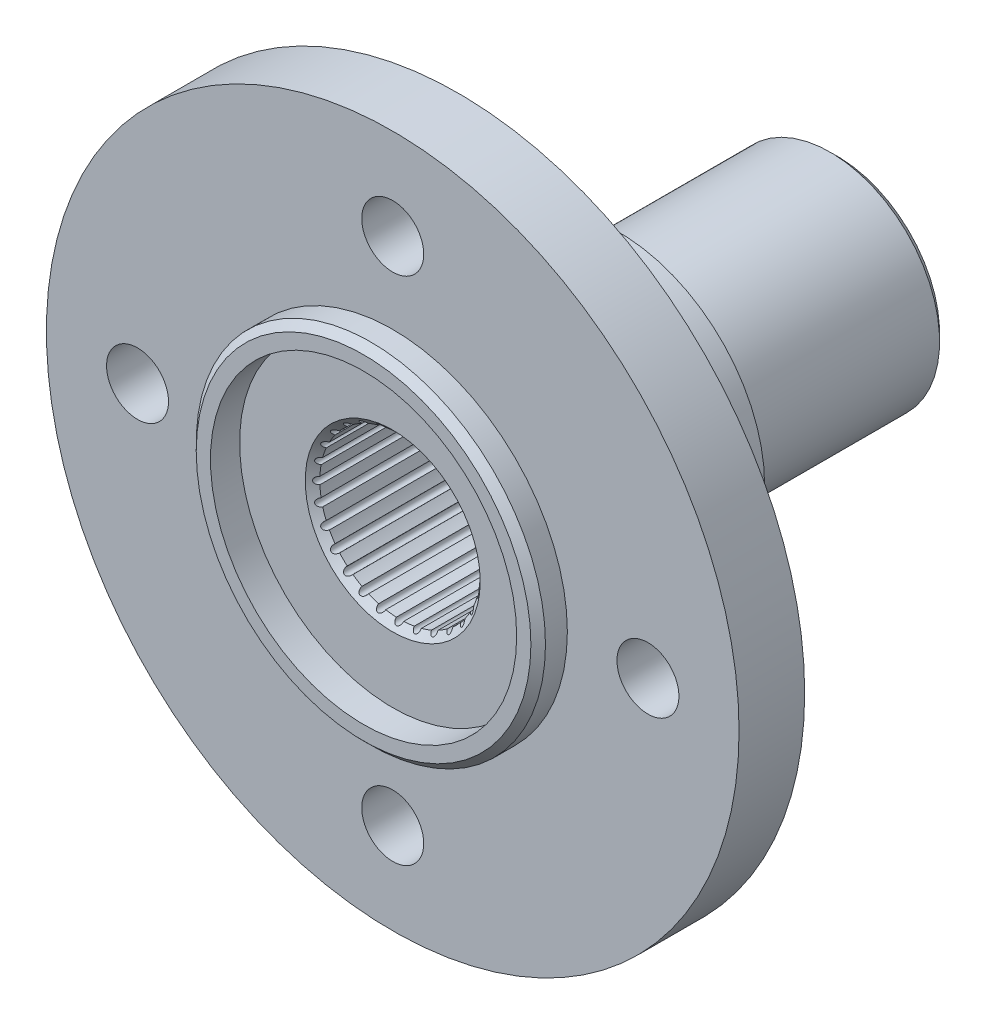
from build123d import *

# Parameters (mm, degrees)
SKETCH1_R           = 47.5
BOSS_EXTRUDE1_DEPTH = 9
SKETCH2_R           = 20
BOSS_EXTRUDE2_DEPTH = 22
SKETCH3_R           = 15
BOSS_EXTRUDE3_DEPTH = 30
SKETCH6_R           = 11
CUT_EXTRUDE2_DEPTH  = 25
CHAMFER2_SIZE       = 1
CUT_EXTRUDE5_REACH  = 92.739
SKETCH9_R           = 4.25
CHAMFER3_SIZE       = 1
SKETCH12_R          = 23.95
BOSS_EXTRUDE4_DEPTH = 4
SKETCH13_R          = 21
CUT_EXTRUDE6_DEPTH  = 4
CHAMFER4_SIZE       = 1
SKETCH8_R           = 0.5
CUT_EXTRUDE4_DEPTH  = 25
SKETCH14_R          = 11
CUT_EXTRUDE7_DEPTH  = 79.182478856
CHAMFER5_SIZE       = 1
SKETCH15_R          = 0.5
CUT_EXTRUDE8_DEPTH  = 94.474595479


with BuildPart() as part:
    # Sketch1 → Boss-Extrude1 (new body)
    with BuildSketch(Plane.XY):
        Circle(SKETCH1_R)
    extrude(amount=BOSS_EXTRUDE1_DEPTH)

    # Sketch2 → Boss-Extrude2 (add)
    with BuildSketch(Plane(origin=(0, 0, 0), x_dir=(-1, 0, 0), z_dir=(0, 0, -1))):
        Circle(SKETCH2_R)
    extrude(amount=BOSS_EXTRUDE2_DEPTH)

    # Sketch3 → Boss-Extrude3 (add)
    with BuildSketch(Plane(origin=(0, 0, -22), x_dir=(-1, 0, 0), z_dir=(0, 0, -1))):
        Circle(SKETCH3_R)
    extrude(amount=BOSS_EXTRUDE3_DEPTH)

    # Sketch6 → Cut-Extrude2 (cut)
    with BuildSketch(Plane(origin=(0, 0, -52), x_dir=(-1, 0, 0), z_dir=(0, 0, -1))):
        Circle(SKETCH6_R)
    extrude(amount=-CUT_EXTRUDE2_DEPTH, mode=Mode.SUBTRACT)

    # Chamfer2
    chamfer2_edges = [part.edges().sort_by_distance(p)[0] for p in [
        (11, 0, -52),
    ]]
    chamfer(chamfer2_edges, length=CHAMFER2_SIZE)

    # Sketch9 → Cut-Extrude5 (cut, up to next)
    with BuildSketch(Plane.XY.offset(9), mode=Mode.PRIVATE) as cut_extrude5_sk1:
        with Locations((0, 35)):
            Circle(SKETCH9_R)
    cut_extrude5_tool1 = extrude(cut_extrude5_sk1.sketch, amount=-CUT_EXTRUDE5_REACH, mode=Mode.PRIVATE) & part.part
    # Sketch9 → Cut-Extrude5 (cut, up to next)
    with BuildSketch(Plane.XY.offset(9), mode=Mode.PRIVATE) as cut_extrude5_sk2:
        with Locations((35, 0)):
            Circle(SKETCH9_R)
    cut_extrude5_tool2 = extrude(cut_extrude5_sk2.sketch, amount=-CUT_EXTRUDE5_REACH, mode=Mode.PRIVATE) & part.part
    # Sketch9 → Cut-Extrude5 (cut, up to next)
    with BuildSketch(Plane.XY.offset(9), mode=Mode.PRIVATE) as cut_extrude5_sk3:
        with Locations((0, -35)):
            Circle(SKETCH9_R)
    cut_extrude5_tool3 = extrude(cut_extrude5_sk3.sketch, amount=-CUT_EXTRUDE5_REACH, mode=Mode.PRIVATE) & part.part
    # Sketch9 → Cut-Extrude5 (cut, up to next)
    with BuildSketch(Plane.XY.offset(9), mode=Mode.PRIVATE) as cut_extrude5_sk4:
        with Locations((-35, 0)):
            Circle(SKETCH9_R)
    cut_extrude5_tool4 = extrude(cut_extrude5_sk4.sketch, amount=-CUT_EXTRUDE5_REACH, mode=Mode.PRIVATE) & part.part
    add(cut_extrude5_tool1.solids().sort_by_distance((0, 35, 9))[0], mode=Mode.SUBTRACT)
    add(cut_extrude5_tool2.solids().sort_by_distance((35, 0, 9))[0], mode=Mode.SUBTRACT)
    add(cut_extrude5_tool3.solids().sort_by_distance((0, -35, 9))[0], mode=Mode.SUBTRACT)
    add(cut_extrude5_tool4.solids().sort_by_distance((-35, 0, 9))[0], mode=Mode.SUBTRACT)

    # Chamfer3
    chamfer3_edges = [part.edges().sort_by_distance(p)[0] for p in [
        (15, 0, -52),
    ]]
    chamfer(chamfer3_edges, length=CHAMFER3_SIZE)

    # Sketch12 → Boss-Extrude4 (add)
    with BuildSketch(Plane.XY.offset(9)):
        Circle(SKETCH12_R)
    extrude(amount=BOSS_EXTRUDE4_DEPTH)

    # Sketch13 → Cut-Extrude6 (cut)
    with BuildSketch(Plane.XY.offset(13)):
        Circle(SKETCH13_R)
    extrude(amount=-CUT_EXTRUDE6_DEPTH, mode=Mode.SUBTRACT)

    # Chamfer4
    chamfer4_edges = [part.edges().sort_by_distance(p)[0] for p in [
        (-23.95, 0, 13),
    ]]
    chamfer(chamfer4_edges, length=CHAMFER4_SIZE)

    # Sketch8 → Cut-Extrude4 (cut)
    with BuildSketch(Plane(origin=(0, 0, -52), x_dir=(-1, 0, 0), z_dir=(0, 0, -1))):
        with Locations((0, 11)):
            Circle(SKETCH8_R)
        with Locations((2.447730274, 10.724207034)):
            Circle(SKETCH8_R)
        with Locations((4.77272113, 9.910657547)):
            Circle(SKETCH8_R)
        with Locations((6.85838782, 8.600146307)):
            Circle(SKETCH8_R)
        with Locations((8.600146307, 6.85838782)):
            Circle(SKETCH8_R)
        with Locations((9.910657547, 4.77272113)):
            Circle(SKETCH8_R)
        with Locations((10.724207034, 2.447730274)):
            Circle(SKETCH8_R)
        with Locations((11, 0)):
            Circle(SKETCH8_R)
        with Locations((10.724207034, -2.447730274)):
            Circle(SKETCH8_R)
        with Locations((9.910657547, -4.77272113)):
            Circle(SKETCH8_R)
        with Locations((8.600146307, -6.85838782)):
            Circle(SKETCH8_R)
        with Locations((6.85838782, -8.600146307)):
            Circle(SKETCH8_R)
        with Locations((4.77272113, -9.910657547)):
            Circle(SKETCH8_R)
        with Locations((2.447730274, -10.724207034)):
            Circle(SKETCH8_R)
        with Locations((0, -11)):
            Circle(SKETCH8_R)
        with Locations((-2.447730274, -10.724207034)):
            Circle(SKETCH8_R)
        with Locations((-4.77272113, -9.910657547)):
            Circle(SKETCH8_R)
        with Locations((-6.85838782, -8.600146307)):
            Circle(SKETCH8_R)
        with Locations((-8.600146307, -6.85838782)):
            Circle(SKETCH8_R)
        with Locations((-9.910657547, -4.77272113)):
            Circle(SKETCH8_R)
        with Locations((-10.724207034, -2.447730274)):
            Circle(SKETCH8_R)
        with Locations((-11, 0)):
            Circle(SKETCH8_R)
        with Locations((-10.724207034, 2.447730274)):
            Circle(SKETCH8_R)
        with Locations((-9.910657547, 4.77272113)):
            Circle(SKETCH8_R)
        with Locations((-8.600146307, 6.85838782)):
            Circle(SKETCH8_R)
        with Locations((-6.85838782, 8.600146307)):
            Circle(SKETCH8_R)
        with Locations((-4.77272113, 9.910657547)):
            Circle(SKETCH8_R)
        with Locations((-2.447730274, 10.724207034)):
            Circle(SKETCH8_R)
    extrude(amount=-CUT_EXTRUDE4_DEPTH, mode=Mode.SUBTRACT)

    # Sketch14 → Cut-Extrude7 (cut, through all)
    with BuildSketch(Plane(origin=(0, 0, -27), x_dir=(-1, 0, 0), z_dir=(0, 0, -1))):
        with Locations(Location((0, 0, 0), (0, 0, 357.39542213))):
            Circle(SKETCH14_R)
    extrude(amount=-CUT_EXTRUDE7_DEPTH, mode=Mode.SUBTRACT)

    # Chamfer5
    chamfer5_edges = [part.edges().sort_by_distance(p)[0] for p in [
        (10.988636364, 0.499870851, 9),
    ]]
    chamfer(chamfer5_edges, length=CHAMFER5_SIZE)

    # Sketch15 → Cut-Extrude8 (cut, through all)
    with BuildSketch(Plane(origin=(0, 0, -52), x_dir=(-1, 0, 0), z_dir=(0, 0, -1))):
        with Locations((8.600146307, 6.85838782)):
            Circle(SKETCH15_R)
        with Locations((6.85838782, 8.600146307)):
            Circle(SKETCH15_R)
        with Locations((4.77272113, 9.910657547)):
            Circle(SKETCH15_R)
        with Locations((2.447730274, 10.724207034)):
            Circle(SKETCH15_R)
        with Locations((0, 11)):
            Circle(SKETCH15_R)
        with Locations((4.77272113, -9.910657547)):
            Circle(SKETCH15_R)
        with Locations((6.85838782, -8.600146307)):
            Circle(SKETCH15_R)
        with Locations((8.600146307, -6.85838782)):
            Circle(SKETCH15_R)
        with Locations((9.910657547, -4.77272113)):
            Circle(SKETCH15_R)
        with Locations((10.724207034, -2.447730274)):
            Circle(SKETCH15_R)
        with Locations((11, 0)):
            Circle(SKETCH15_R)
        with Locations((10.724207034, 2.447730274)):
            Circle(SKETCH15_R)
        with Locations((9.910657547, 4.77272113)):
            Circle(SKETCH15_R)
        with Locations((-10.724207034, -2.447730274)):
            Circle(SKETCH15_R)
        with Locations((-9.910657547, -4.77272113)):
            Circle(SKETCH15_R)
        with Locations((-8.600146307, -6.85838782)):
            Circle(SKETCH15_R)
        with Locations((-6.85838782, -8.600146307)):
            Circle(SKETCH15_R)
        with Locations((-4.77272113, -9.910657547)):
            Circle(SKETCH15_R)
        with Locations((-2.447730274, -10.724207034)):
            Circle(SKETCH15_R)
        with Locations((0, -11)):
            Circle(SKETCH15_R)
        with Locations((2.447730274, -10.724207034)):
            Circle(SKETCH15_R)
        with Locations((-2.447730274, 10.724207034)):
            Circle(SKETCH15_R)
        with Locations((-4.77272113, 9.910657547)):
            Circle(SKETCH15_R)
        with Locations((-6.85838782, 8.600146307)):
            Circle(SKETCH15_R)
        with Locations((-8.600146307, 6.85838782)):
            Circle(SKETCH15_R)
        with Locations((-9.910657547, 4.77272113)):
            Circle(SKETCH15_R)
        with Locations((-10.724207034, 2.447730274)):
            Circle(SKETCH15_R)
        with Locations((-11, 0)):
            Circle(SKETCH15_R)
    extrude(amount=-CUT_EXTRUDE8_DEPTH, mode=Mode.SUBTRACT)


solid = part.part
